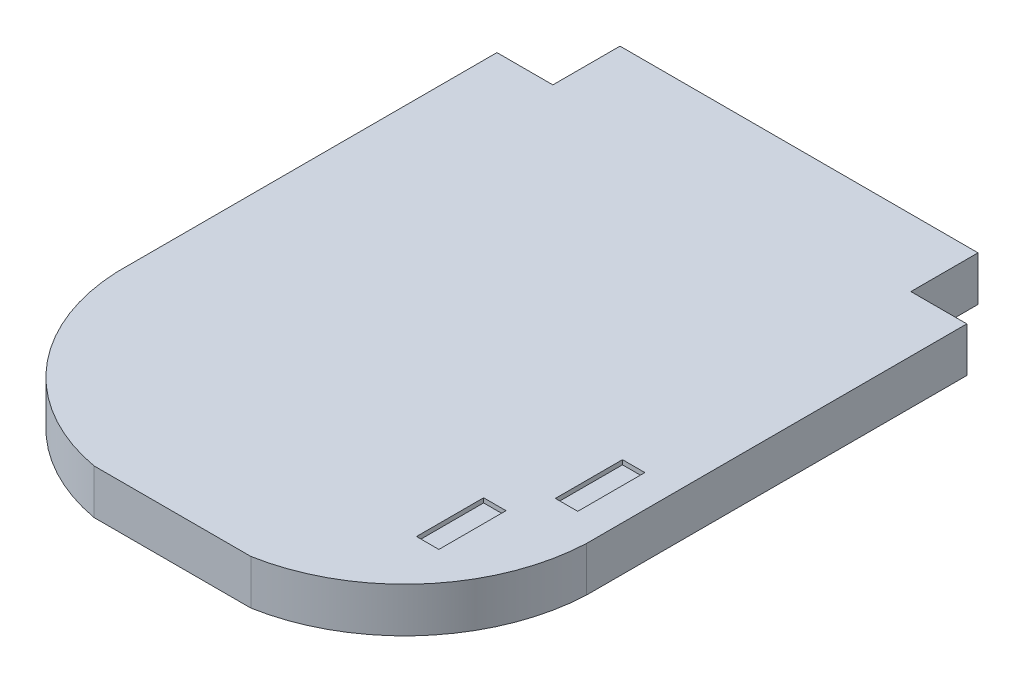
from build123d import *

# Parameters (mm, degrees)
EXTRUDE_1_DEPTH     = 2
SKETCH_2_W          = 1
SKETCH_2_H          = 3
CUT_EXTRUDE_1_DEPTH = 0.2


with BuildPart() as part:
    # 草图1 → 凸台-拉伸1 (new body)
    with BuildSketch(Plane(origin=(0, 0, 0), x_dir=(1, 0, 0), z_dir=(0, 1, 0))):
        with BuildLine():
            Line((-8, 14), (8, 14))
            Line((8, 14), (8, 11))
            Line((8, 11), (10.5, 11))
            Line((10.5, 11), (10.5, -6))
            ThreePointArc((10.5, -6), (8.403124237, -11.227733708), (3.5, -14))
            Line((3.5, -14), (-3.5, -14))
            ThreePointArc((-3.5, -14), (-8.403124237, -11.227733708), (-10.5, -6))
            Line((-10.5, -6), (-10.5, 11))
            Line((-10.5, 11), (-8, 11))
            Line((-8, 11), (-8, 14))
        make_face()
    extrude(amount=EXTRUDE_1_DEPTH)

    # 草图2 → 切除-拉伸1 (cut)
    with BuildSketch(Plane(origin=(0, 2, 0), x_dir=(1, 0, 0), z_dir=(0, 1, 0))):
        with Locations((8.561436861, -3.449742869)):
            Rectangle(SKETCH_2_W, SKETCH_2_H)
        with Locations((6.933076326, -8.027614823)):
            Rectangle(SKETCH_2_W, SKETCH_2_H)
    extrude(amount=-CUT_EXTRUDE_1_DEPTH, mode=Mode.SUBTRACT)


solid = part.part
